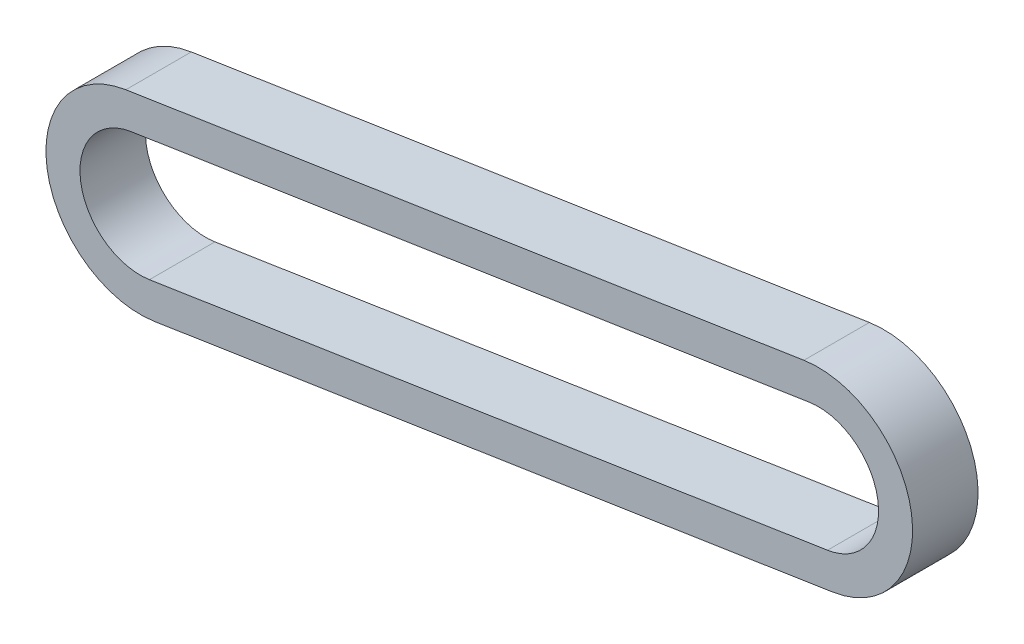
from build123d import *

# Parameters (mm, degrees)
BOSS_EXTRUDE1_DEPTH = 3.175


with BuildPart() as part:
    # Sketch1 → Boss-Extrude1 (new body)
    with BuildSketch(Plane.XY):
        with BuildLine():
            Line((32.185912053, 9.598402227), (-0.698015267, 4.518402227))
            ThreePointArc((-0.698015267, 4.518402227), (-4.518402227, -0.698015267), (0.698015267, -4.518402227))
            Line((0.698015267, -4.518402227), (33.581942587, 0.561597773))
            ThreePointArc((33.581942587, 0.561597773), (37.402329547, 5.778015267), (32.185912053, 9.598402227))
        make_face()
        with BuildLine():
            Line((0.445954198, -2.886756978), (33.329881519, 2.193243022))
            ThreePointArc((33.329881519, 2.193243022), (35.770684299, 5.525954198), (32.437973122, 7.966756978))
            Line((32.437973122, 7.966756978), (-0.445954198, 2.886756978))
            ThreePointArc((-0.445954198, 2.886756978), (-2.886756978, -0.445954198), (0.445954198, -2.886756978))
        make_face(mode=Mode.SUBTRACT)
    extrude(amount=BOSS_EXTRUDE1_DEPTH)


solid = part.part
